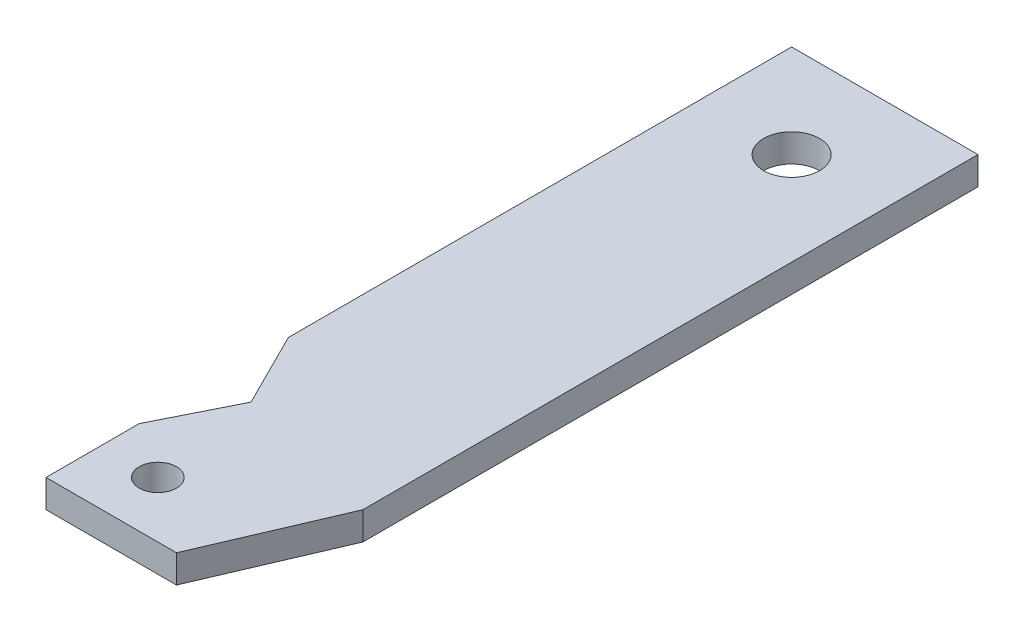
from build123d import *

# Parameters (mm, degrees)
ESQUISSE1_W      = 10
ESQUISSE1_H      = 1.5
EXTRUSION1_DEPTH = 40
ESQUISSE2_R      = 1
ESQUISSE2_R_2    = 1.5
EXTRUSION2_DEPTH = 50


with BuildPart() as part:
    # Esquisse1 → Extrusion1 (new body)
    with BuildSketch(Plane.XY):
        with Locations((-7.772581117, 10.840421053)):
            Rectangle(ESQUISSE1_W, ESQUISSE1_H)
    extrude(amount=EXTRUSION1_DEPTH)

    # Esquisse2 → Extrusion2 (cut)
    with BuildSketch(Plane(origin=(0, 11.590421053, 0), x_dir=(-1, 0, 0), z_dir=(0, 1, 0))):
        with Locations(Location((9.772581117, 37, 0), (0, 0, 90))):
            Circle(ESQUISSE2_R)
        with Locations(Location((7.772581117, 5, 0), (0, 0, 90))):
            Circle(ESQUISSE2_R_2)
        Polygon((12.772581117, 35), (10.772581117, 31), (12.772581117, 27), align=None)
        Polygon((5.772581117, 40), (2.772581117, 40), (2.772581117, 33), align=None)
    extrude(amount=-EXTRUSION2_DEPTH, mode=Mode.SUBTRACT)


solid = part.part
